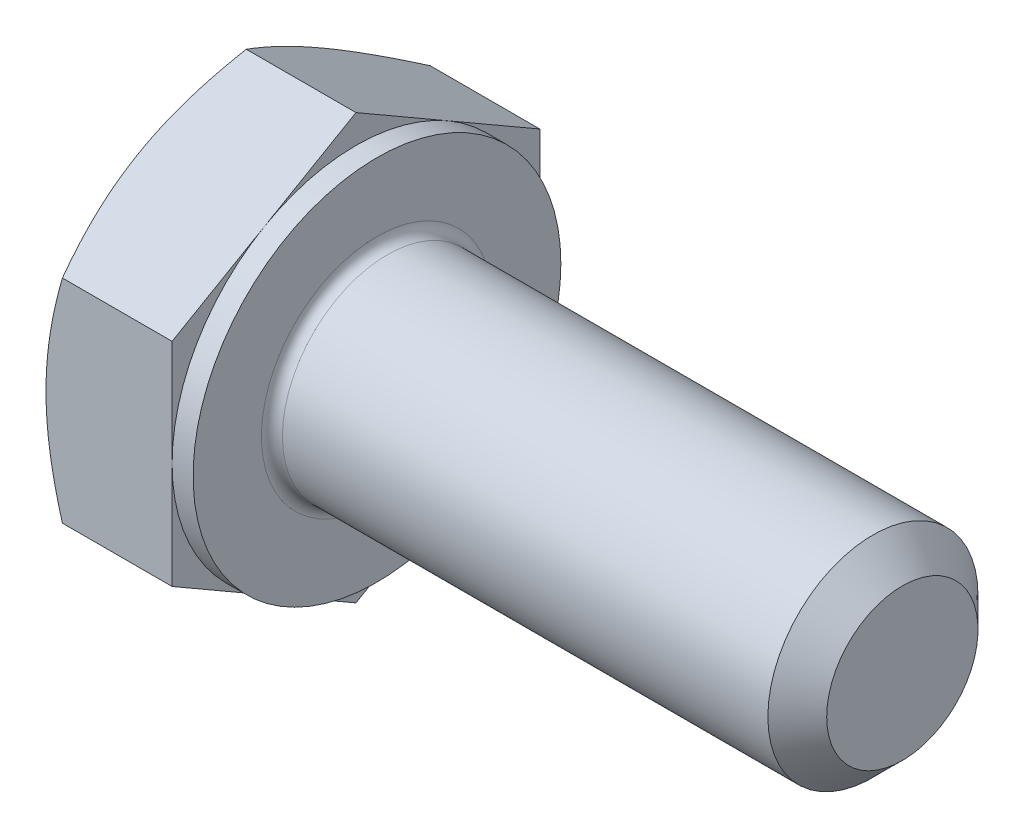
from build123d import *

# Parameters (mm, degrees)
EXTRUDE_360_DEPTH = 2.8
SKETCH_4_W        = 0.4
SKETCH_4_H        = 10.541451884
CHAMFER_1921_SIZE = 0.56
FILLET_1966_R     = 0.2


with BuildPart() as part:
    # 草图1 → Extrude 360 (new body)
    with BuildSketch(Plane(origin=(0, 0, 0), x_dir=(0, 0, -1), z_dir=(1, 0, 0))):
        Polygon((3.5, 2.020725942), (3.5, -2.020725942), (0, -4.041451884), (-3.5, -2.020725942), (-3.5, 2.020725942), (0, 4.041451884), align=None)
    extrude(amount=EXTRUDE_360_DEPTH)

    # 草图2 → 凸台-旋转1 (revolve)
    with BuildSketch(Plane.XY, mode=Mode.PRIVATE) as revolve_1_sk:
        Polygon((0, 0), (12.8, 0), (12.8, 1.3938), (12.8, 2), (0, 2), align=None)
    revolve(revolve_1_sk.sketch.rotate(Axis((0, 0, 0), (1, 0, 0)), 90), axis=Axis((0, 0, 0), (1, 0, 0)))

    # 草图3 → 切除-旋转1 (revolve, cut)
    with BuildSketch(Plane.XY):
        Polygon((0, 3.5), (3.199358737, 9.041451884), (3.199358737, 14.041451884), (-10, 14.041451884), (-10, 3.5), align=None)
    revolve(axis=Axis((0, 0, 0), (1, 0, 0)), mode=Mode.SUBTRACT)

    # 草图5 → 切除-旋转2 (revolve, cut)
    with BuildSketch(Plane.XY):
        Polygon((2.8, 3.5), (-0.399358737, 9.041451884), (-0.399358737, 14.041451884), (9.600641263, 14.041451884), (9.600641263, 3.5), align=None)
    revolve(axis=Axis((0, 0, 0), (1, 0, 0)), mode=Mode.SUBTRACT)

    # 草图4 → 切除-旋转3 (revolve, cut)
    with BuildSketch(Plane.XY, mode=Mode.PRIVATE) as cut_revolve_3_sk:
        with Locations((2.6, 8.770725942)):
            Rectangle(SKETCH_4_W, SKETCH_4_H)
    revolve(cut_revolve_3_sk.sketch.rotate(Axis((0, 0, 0), (1, 0, 0)), 270), axis=Axis((0, 0, 0), (1, 0, 0)), mode=Mode.SUBTRACT)

    # Chamfer 1921
    chamfer_1921_edges = [part.edges().sort_by_distance(p)[0] for p in [
        (12.8, 0, -2),
    ]]
    chamfer(chamfer_1921_edges, length=CHAMFER_1921_SIZE)

    # Fillet 1966
    fillet_1966_edges = [part.edges().sort_by_distance(p)[0] for p in [
        (2.8, 0, -2),
    ]]
    fillet(fillet_1966_edges, radius=FILLET_1966_R)


solid = part.part
